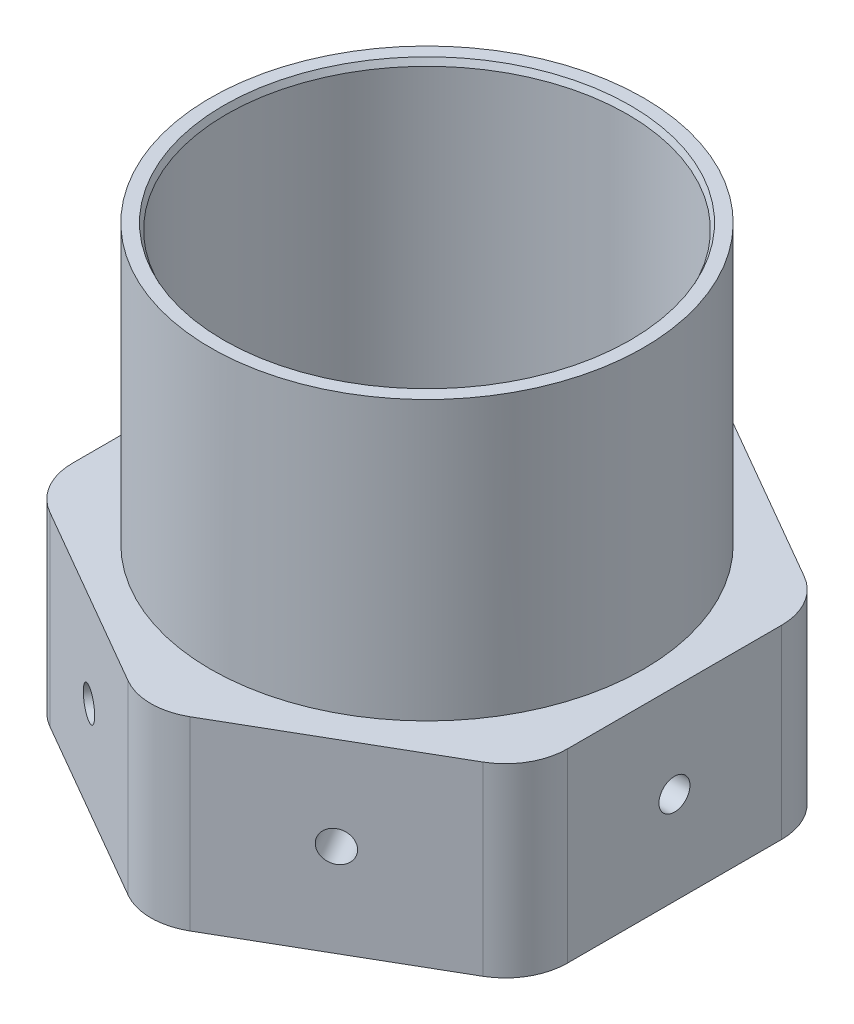
from build123d import *

# Parameters (mm, degrees)
SKETCH1_R           = 41.148
BOSS_EXTRUDE1_DEPTH = 38.1
SKETCH2_R           = 3.18135
CUT_EXTRUDE1_DEPTH  = 29.464
CIRPATTERN1_COUNT   = 6
SKETCH3_R           = 44.45
SKETCH3_R_2         = 41.148
BOSS_EXTRUDE2_DEPTH = 57.15
FILLET1_R           = 12.7
CHAMFER1_SIZE       = 1.27
CHAMFER1_SIZE2      = 0.592210726


with BuildPart() as part:
    # Sketch1 → Boss-Extrude1 (new body)
    with BuildSketch(Plane(origin=(0, 0, 0), x_dir=(1, 0, 0), z_dir=(0, 1, 0))):
        Polygon((0, -58.65878735), (50.8, -29.329393675), (50.8, 29.329393675), (0, 58.65878735), (-50.8, 29.329393675), (-50.8, -29.329393675), align=None)
        with Locations(Location((0, 0, 0), (0, 0, 90))):
            Circle(SKETCH1_R, mode=Mode.SUBTRACT)
    extrude(amount=BOSS_EXTRUDE1_DEPTH)

    # Sketch2 → Cut-Extrude1 (cut)
    with BuildSketch(Plane.ZY.offset(50.8)):
        with Locations((0, 19.05)):
            Circle(SKETCH2_R)
    cut_extrude1 = extrude(amount=-CUT_EXTRUDE1_DEPTH, mode=Mode.SUBTRACT)

    # CirPattern1: Cut-Extrude1 ×6 about axis
    cirpattern1_axis = Axis((0, 38.1, 0), (0, 1, 0))
    for i in range(1, CIRPATTERN1_COUNT):
        add(cut_extrude1.rotate(cirpattern1_axis, i * 360 / CIRPATTERN1_COUNT), mode=Mode.SUBTRACT)

    # Sketch3 → Boss-Extrude2 (add)
    with BuildSketch(Plane(origin=(-50.8, 38.1, -29.329393675), x_dir=(1, 0, 0), z_dir=(0, -1, 0))):
        with Locations(Location((50.8, 29.329393675, 0), (0, 0, 270))):
            Circle(SKETCH3_R)
        with Locations(Location((50.8, 29.329393675, 0), (0, 0, 270))):
            Circle(SKETCH3_R_2, mode=Mode.SUBTRACT)
    extrude(amount=-BOSS_EXTRUDE2_DEPTH)

    # Fillet1
    fillet1_edges = [part.edges().sort_by_distance(p)[0] for p in [
        (-50.8, 19.05, 29.329393675),
        (-50.8, 19.05, -29.329393675),
        (0, 19.05, -58.65878735),
        (50.8, 19.05, -29.329393675),
        (50.8, 19.05, 29.329393675),
        (0, 19.05, 58.65878735),
    ]]
    fillet(fillet1_edges, radius=FILLET1_R)

    # Chamfer1
    chamfer1_edges = [part.edges().sort_by_distance(p)[0] for p in [
        (0, 0, 41.148),
        (0, 95.25, 41.148),
    ]]
    chamfer1_side = [part.faces().sort_by_distance(p)[0] for p in [
        (0, 47.625, 41.148),
    ]]
    chamfer(chamfer1_edges, length=CHAMFER1_SIZE, length2=CHAMFER1_SIZE2, reference=chamfer1_side[0])


solid = part.part
